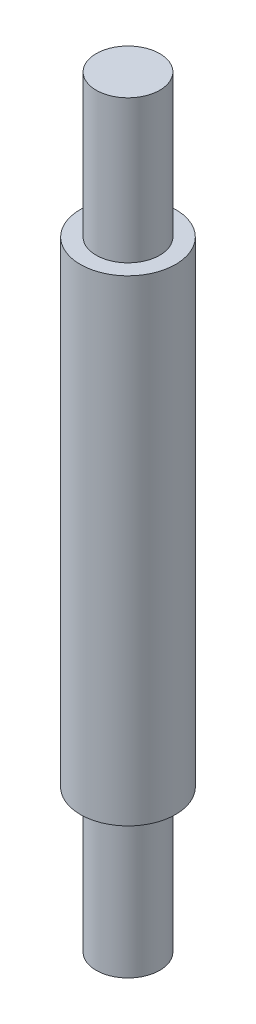
from build123d import *

# Parameters (mm, degrees)
SKETCH1_R           = 15
BOSS_EXTRUDE1_DEPTH = 75
SKETCH2_R           = 10
BOSS_EXTRUDE2_DEPTH = 45


with BuildPart() as part:
    # Sketch1 → Boss-Extrude1 (new, symmetric)
    with BuildSketch(Plane(origin=(0, 0, 0), x_dir=(-1, 0, 0), z_dir=(0, 1, 0))):
        with Locations(Location((0, 0, 0), (0, 0, 90))):
            Circle(SKETCH1_R)
    extrude(amount=BOSS_EXTRUDE1_DEPTH, both=True)

    # Sketch2 → Boss-Extrude2 (add)
    with BuildSketch(Plane(origin=(0, 75, 0), x_dir=(-1, 0, 0), z_dir=(0, 1, 0))):
        with Locations(Location((0, 0, 0), (0, 0, 270))):
            Circle(SKETCH2_R)
    boss_extrude2 = extrude(amount=BOSS_EXTRUDE2_DEPTH)

    # Mirror1: Boss-Extrude2 across plane
    add(boss_extrude2.mirror(Plane.ZX))


solid = part.part
